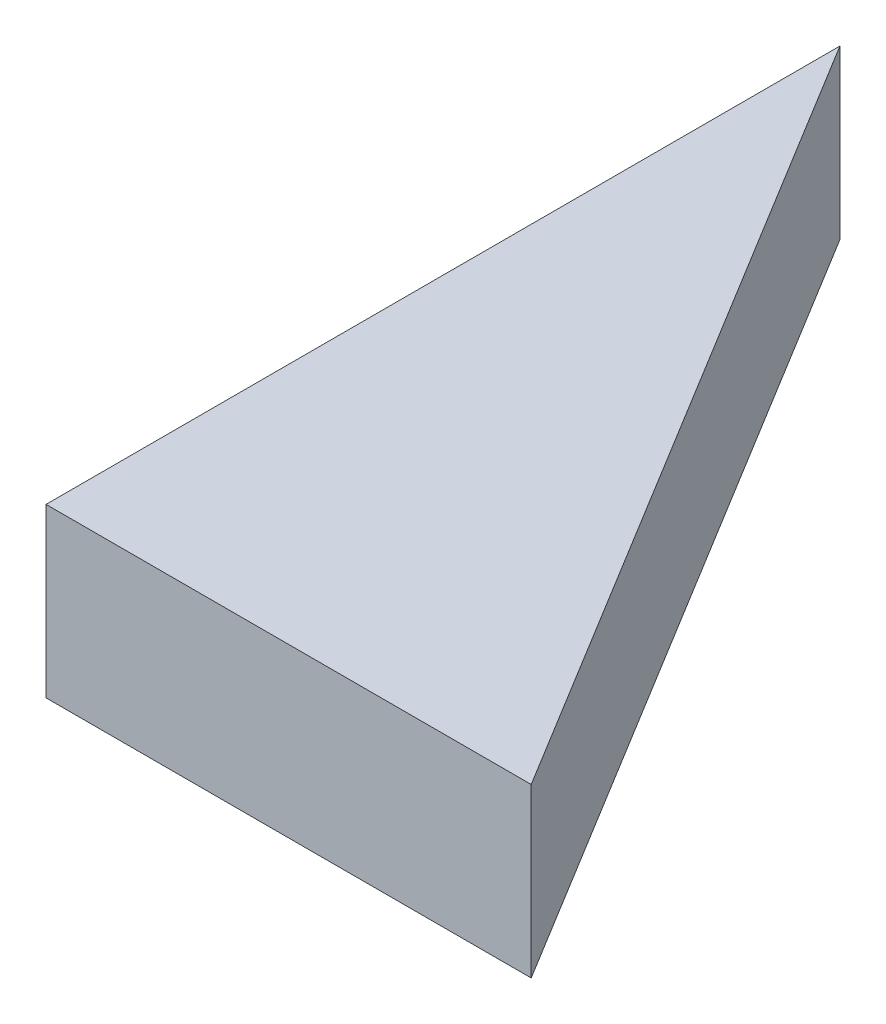
from build123d import *

# Parameters (mm, degrees)
BOSS_EXTRUDE1_DEPTH = 48.26


with BuildPart() as part:
    # Sketch1 → Boss-Extrude1 (new body)
    with BuildSketch(Plane(origin=(0, 0, 0), x_dir=(1, 0, 0), z_dir=(0, 1, 0))):
        Polygon((0, 0), (139.7, 0), (0, 228.6), align=None)
    extrude(amount=BOSS_EXTRUDE1_DEPTH)


solid = part.part
